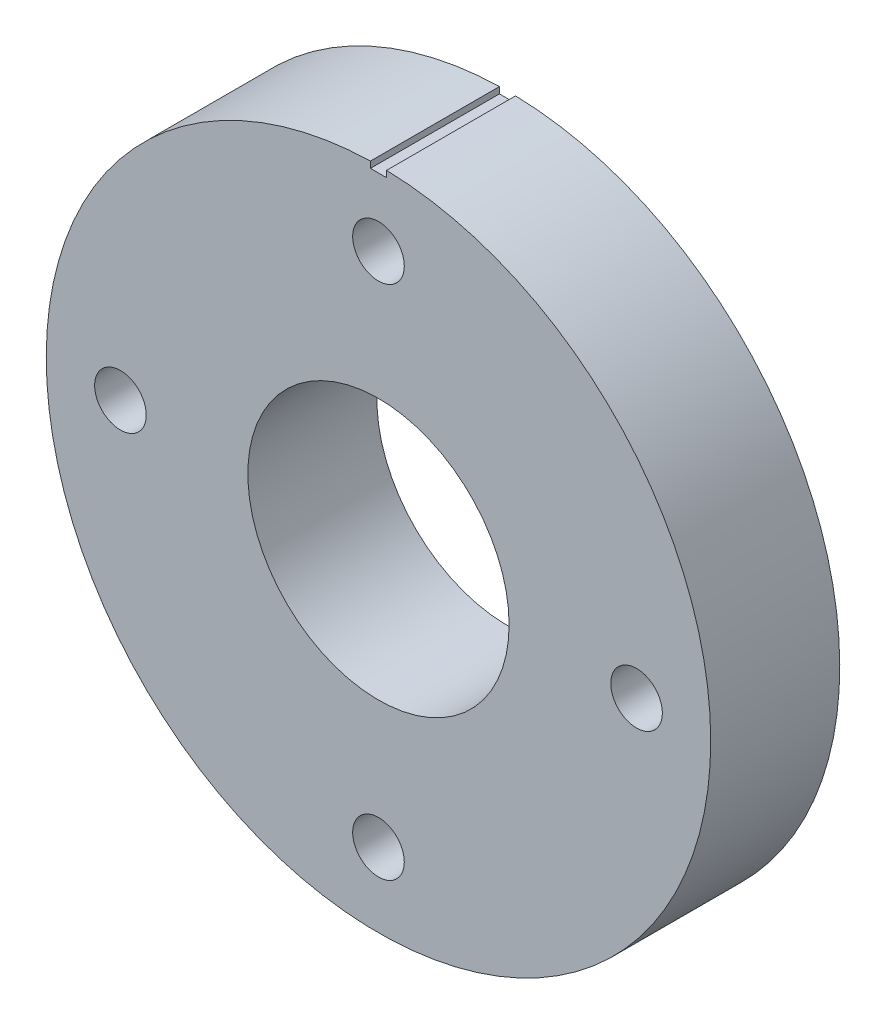
from build123d import *

# Parameters (mm, degrees)
BOSS_EXTRUDE1_DEPTH = 4


with BuildPart() as part:
    # Sketch2 → Boss-Extrude1 (new body)
    with BuildSketch(Plane.XY):
        with BuildLine():
            Line((-0.25, -0.9), (-0.25, -0.703034428))
            ThreePointArc((-0.25, -0.703034428), (-7.371058269, -3.805731448), (-10.3, -11))
            ThreePointArc((-10.3, -11), (0, -21.3), (10.3, -11))
            ThreePointArc((10.3, -11), (7.371058269, -3.805731448), (0.25, -0.703034428))
            Line((0.25, -0.703034428), (0.25, -0.9))
            Line((0.25, -0.9), (-0.25, -0.9))
        make_face()
        with BuildLine():
            ThreePointArc((-8.8, -11), (-8, -11.8), (-7.2, -11))
            ThreePointArc((-7.2, -11), (-8, -10.2), (-8.8, -11))
        make_face(mode=Mode.SUBTRACT)
        with BuildLine():
            ThreePointArc((0.8, -3), (0, -2.2), (-0.8, -3))
            ThreePointArc((-0.8, -3), (0, -3.8), (0.8, -3))
        make_face(mode=Mode.SUBTRACT)
        with BuildLine():
            ThreePointArc((0.8, -19), (0, -18.2), (-0.8, -19))
            ThreePointArc((-0.8, -19), (0, -19.8), (0.8, -19))
        make_face(mode=Mode.SUBTRACT)
        with BuildLine():
            ThreePointArc((8.8, -11), (8, -10.2), (7.2, -11))
            ThreePointArc((7.2, -11), (8, -11.8), (8.8, -11))
        make_face(mode=Mode.SUBTRACT)
        with BuildLine():
            ThreePointArc((4.05, -11), (0, -6.95), (-4.05, -11))
            ThreePointArc((-4.05, -11), (0, -15.05), (4.05, -11))
        make_face(mode=Mode.SUBTRACT)
    extrude(amount=BOSS_EXTRUDE1_DEPTH)


solid = part.part
